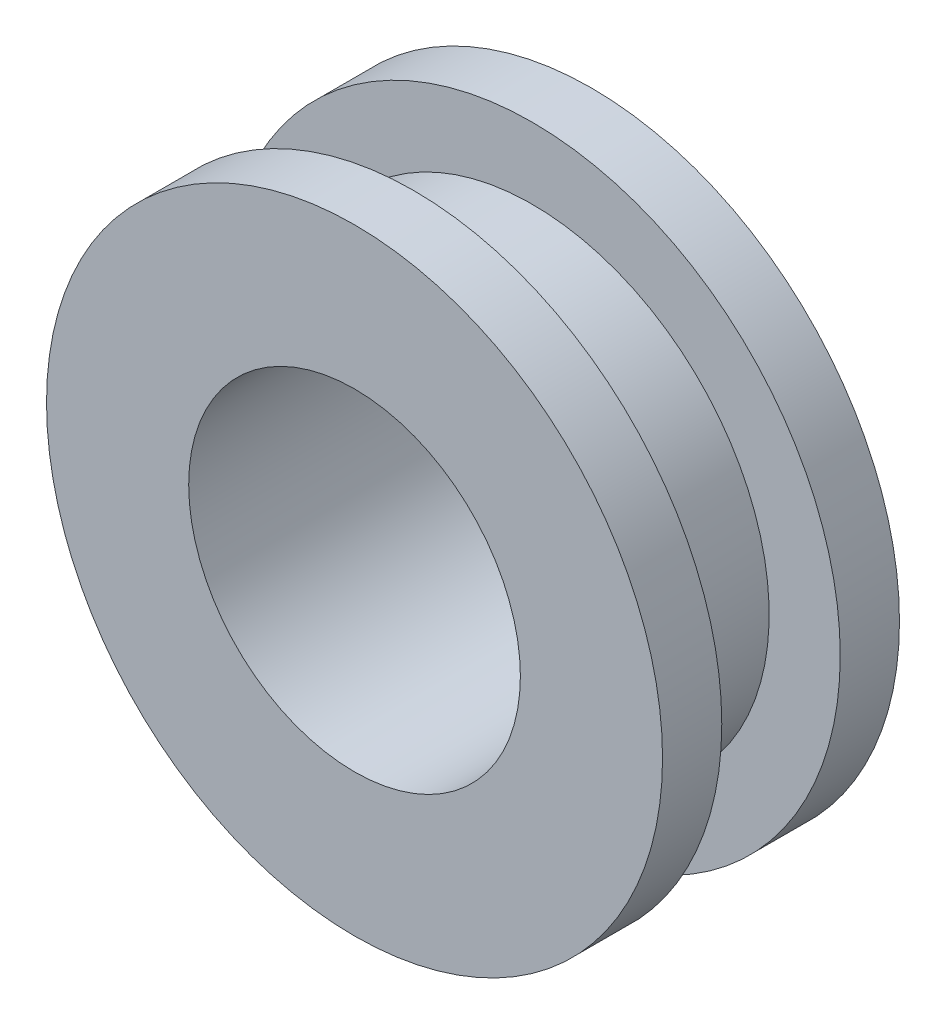
from build123d import *

# Parameters (mm, degrees)
ESQUISSE1_R        = 6.5
ESQUISSE1_R_2      = 3.5
BOSS_EXTRU_1_DEPTH = 5
ESQUISSE2_W        = 1.5
ESQUISSE2_H        = 2.5


with BuildPart() as part:
    # Esquisse1 → Boss.-Extru.1 (new body)
    with BuildSketch(Plane.XY):
        Circle(ESQUISSE1_R)
        Circle(ESQUISSE1_R_2, mode=Mode.SUBTRACT)
    extrude(amount=BOSS_EXTRU_1_DEPTH)

    # Esquisse2 → Enlèvement de matière-Révolution1 (revolve, cut)
    with BuildSketch(Plane(origin=(0, 0, 0), x_dir=(1, 0, 0), z_dir=(0, 1, 0)), mode=Mode.PRIVATE) as enl_vement_de_mati_re_r_volution1_sk:
        with Locations((5.75, -2.5)):
            Rectangle(ESQUISSE2_W, ESQUISSE2_H)
    revolve(enl_vement_de_mati_re_r_volution1_sk.sketch.rotate(Axis((0, 0, -1.624351993), (0, 0, 1)), 180), axis=Axis((0, 0, -1.624351993), (0, 0, 1)), mode=Mode.SUBTRACT)


solid = part.part
